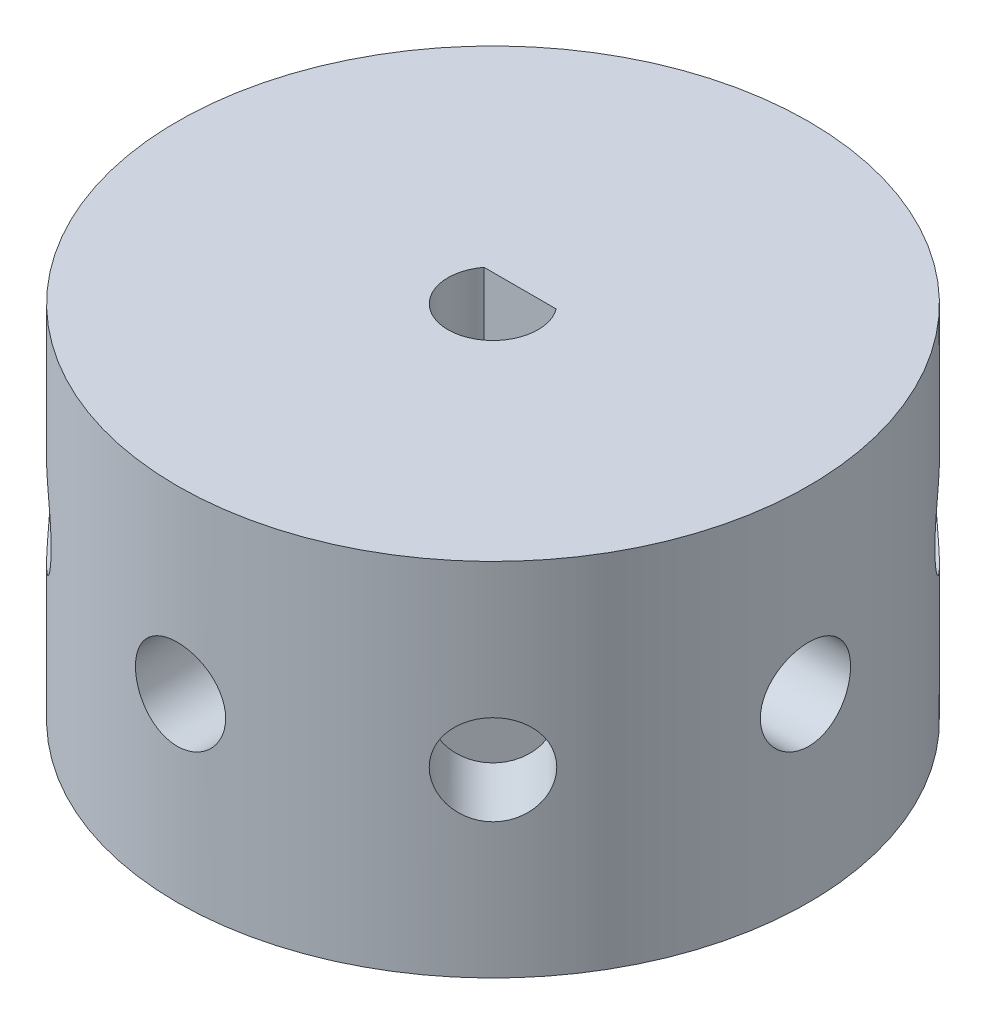
from build123d import *

# Parameters (mm, degrees)
SKETCH1_R           = 35
BOSS_EXTRUDE1_DEPTH = 40
SKETCH7_R           = 5
CUT_EXTRUDE4_DEPTH  = 8
CIRPATTERN1_COUNT   = 8


with BuildPart() as part:
    # Sketch1 → Boss-Extrude1 (new body)
    with BuildSketch(Plane(origin=(0, 0, 0), x_dir=(1, 0, 0), z_dir=(0, 1, 0))):
        with Locations(Location((0, 0, 0), (0, 0, 270))):
            Circle(SKETCH1_R)
        with BuildLine():
            Line((-4, 3), (4, 3))
            ThreePointArc((4, 3), (0, -5), (-4, 3))
        make_face(mode=Mode.SUBTRACT)
    extrude(amount=BOSS_EXTRUDE1_DEPTH)

    # Sketch7 → Cut-Extrude4 (cut)
    with BuildSketch(Plane(origin=(0, 0, -35), x_dir=(-1, 0, 0), z_dir=(0, 0, -1))):
        with Locations((0, 20)):
            Circle(SKETCH7_R)
    cut_extrude4 = extrude(amount=-CUT_EXTRUDE4_DEPTH, mode=Mode.SUBTRACT)

    # CirPattern1: Cut-Extrude4 ×8 about axis
    cirpattern1_axis = Axis((0, 0, 0), (0, 1, 0))
    for i in range(1, CIRPATTERN1_COUNT):
        add(cut_extrude4.rotate(cirpattern1_axis, i * 360 / CIRPATTERN1_COUNT), mode=Mode.SUBTRACT)


solid = part.part
